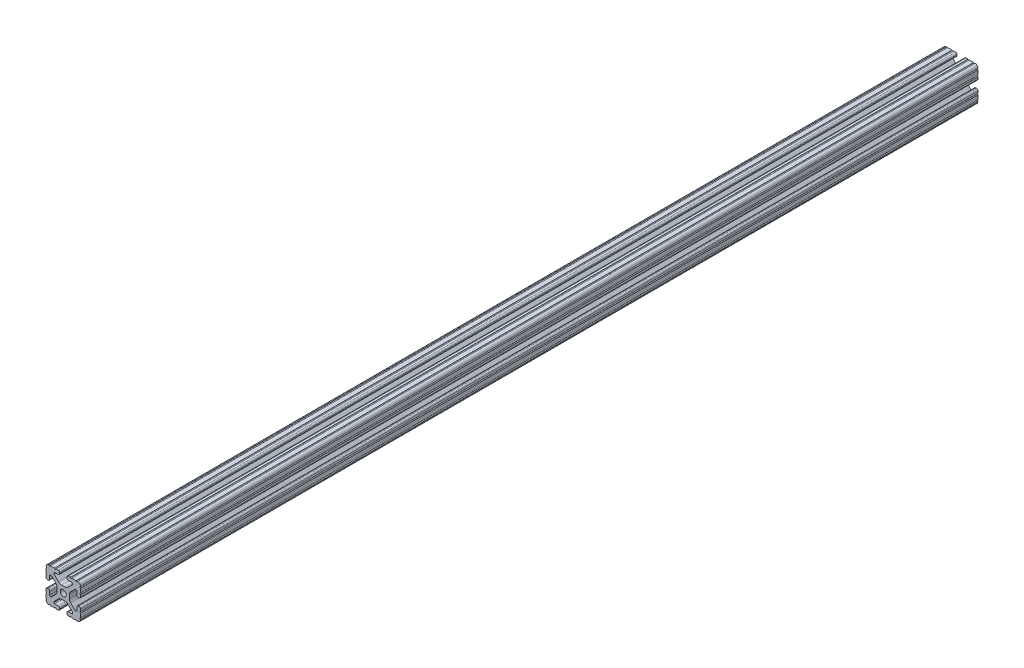
from build123d import *

# Parameters (mm, degrees)
SKETCH1_R      = 3.3274
EXTRUDE1_DEPTH = 990.6


with BuildPart() as part:
    # Sketch1 → Extrude1 (new body)
    with BuildSketch(Plane.XY):
        with BuildLine():
            Line((-10.022898969, 12.91475973), (-5.252158105, 8.144007132))
            ThreePointArc((-5.252158105, 8.144007132), (-3.715177372, 7.117027388), (-1.902183975, 6.7564))
            Line((-1.902183975, 6.7564), (1.902183975, 6.7564))
            ThreePointArc((1.902183975, 6.7564), (3.715177372, 7.117027388), (5.252158105, 8.144007132))
            Line((5.252158105, 8.144007132), (10.022898969, 12.91475973))
            ThreePointArc((10.022898969, 12.91475973), (10.218362387, 13.207291992), (10.287, 13.552357131))
            Line((10.287, 13.552357131), (10.287, 14.0843))
            ThreePointArc((10.287, 14.0843), (10.022898185, 14.721898185), (9.3853, 14.986))
            Line((9.3853, 14.986), (5.617617549, 14.986))
            ThreePointArc((5.617617549, 14.986), (4.519044045, 15.441044045), (4.064, 16.539617549))
            Line((4.064, 16.539617549), (4.064, 17.496382451))
            ThreePointArc((4.064, 17.496382451), (4.519044045, 18.594955955), (5.617617549, 19.05))
            Line((5.617617549, 19.05), (7.974178704, 19.05))
            ThreePointArc((7.974178704, 19.05), (8.736178704, 18.288), (9.498178704, 19.05))
            Line((9.498178704, 19.05), (14.327719207, 19.05))
            ThreePointArc((14.327719207, 19.05), (15.087603123, 18.231251131), (15.847487039, 19.05))
            ThreePointArc((15.847487039, 19.05), (18.120176289, 18.120192083), (19.05, 15.847509295))
            ThreePointArc((19.05, 15.847509295), (18.231250992, 15.08762539), (19.05, 14.327741484))
            Line((19.05, 14.327741484), (19.05, 9.496091471))
            ThreePointArc((19.05, 9.496091471), (18.231250992, 8.736207565), (19.05, 7.97632366))
            Line((19.05, 7.97632366), (19.05, 5.617617549))
            ThreePointArc((19.05, 5.617617549), (18.594955955, 4.519044045), (17.496382451, 4.064))
            Line((17.496382451, 4.064), (16.539617549, 4.064))
            ThreePointArc((16.539617549, 4.064), (15.441044045, 4.519044045), (14.986, 5.617617549))
            Line((14.986, 5.617617549), (14.986, 9.385342516))
            ThreePointArc((14.986, 9.385342516), (14.721898185, 10.022940701), (14.0843, 10.287042516))
            Line((14.0843, 10.287042516), (13.516042086, 10.287042516))
            ThreePointArc((13.516042086, 10.287042516), (13.170975923, 10.218404478), (12.878443117, 10.022939917))
            Line((12.878443117, 10.022939917), (8.14758008, 5.292065243))
            ThreePointArc((8.14758008, 5.292065243), (7.117955879, 3.751120653), (6.7564, 1.933453584))
            Line((6.7564, 1.933453584), (6.7564, -1.933453584))
            ThreePointArc((6.7564, -1.933453584), (7.117955879, -3.751120653), (8.14758008, -5.292065243))
            Line((8.14758008, -5.292065243), (12.878443117, -10.022939917))
            ThreePointArc((12.878443117, -10.022939917), (13.170975923, -10.218404478), (13.516042086, -10.287042516))
            Line((13.516042086, -10.287042516), (14.0843, -10.287042516))
            ThreePointArc((14.0843, -10.287042516), (14.721898185, -10.022940701), (14.986, -9.385342516))
            Line((14.986, -9.385342516), (14.986, -5.617617549))
            ThreePointArc((14.986, -5.617617549), (15.441044045, -4.519044045), (16.539617549, -4.064))
            Line((16.539617549, -4.064), (17.496382451, -4.064))
            ThreePointArc((17.496382451, -4.064), (18.594955955, -4.519044045), (19.05, -5.617617549))
            Line((19.05, -5.617617549), (19.05, -7.976318491))
            ThreePointArc((19.05, -7.976318491), (18.231250992, -8.736202396), (19.05, -9.496086302))
            Line((19.05, -9.496086302), (19.05, -14.32774291))
            ThreePointArc((19.05, -14.32774291), (18.231250992, -15.087626816), (19.05, -15.847510721))
            ThreePointArc((19.05, -15.847510721), (18.120175716, -18.120192644), (15.847486868, -19.05))
            ThreePointArc((15.847486868, -19.05), (15.087602952, -18.231251131), (14.327719036, -19.05))
            Line((14.327719036, -19.05), (9.496062448, -19.05))
            ThreePointArc((9.496062448, -19.05), (8.736178532, -18.231251131), (7.976294616, -19.05))
            Line((7.976294616, -19.05), (5.617617549, -19.05))
            ThreePointArc((5.617617549, -19.05), (4.519044045, -18.594955955), (4.064, -17.496382451))
            Line((4.064, -17.496382451), (4.064, -16.539617549))
            ThreePointArc((4.064, -16.539617549), (4.519044045, -15.441044045), (5.617617549, -14.986))
            Line((5.617617549, -14.986), (9.3853, -14.986))
            ThreePointArc((9.3853, -14.986), (10.022898185, -14.721898185), (10.287, -14.0843))
            Line((10.287, -14.0843), (10.287, -13.552357131))
            ThreePointArc((10.287, -13.552357131), (10.218362387, -13.207291992), (10.022898969, -12.91475973))
            Line((10.022898969, -12.91475973), (5.252158105, -8.144007132))
            ThreePointArc((5.252158105, -8.144007132), (3.715177372, -7.117027388), (1.902183975, -6.7564))
            Line((1.902183975, -6.7564), (-1.902183975, -6.7564))
            ThreePointArc((-1.902183975, -6.7564), (-3.715177372, -7.117027388), (-5.252158105, -8.144007132))
            Line((-5.252158105, -8.144007132), (-10.022898969, -12.91475973))
            ThreePointArc((-10.022898969, -12.91475973), (-10.218362387, -13.207291992), (-10.287, -13.552357131))
            Line((-10.287, -13.552357131), (-10.287, -14.0843))
            ThreePointArc((-10.287, -14.0843), (-10.022898185, -14.721898185), (-9.3853, -14.986))
            Line((-9.3853, -14.986), (-5.617617549, -14.986))
            ThreePointArc((-5.617617549, -14.986), (-4.519044045, -15.441044045), (-4.064, -16.539617549))
            Line((-4.064, -16.539617549), (-4.064, -17.496382451))
            ThreePointArc((-4.064, -17.496382451), (-4.519044045, -18.594955955), (-5.617617549, -19.05))
            Line((-5.617617549, -19.05), (-7.976294616, -19.05))
            ThreePointArc((-7.976294616, -19.05), (-8.736178532, -18.231251131), (-9.496062448, -19.05))
            Line((-9.496062448, -19.05), (-14.327719036, -19.05))
            ThreePointArc((-14.327719036, -19.05), (-15.087602952, -18.231251131), (-15.847486868, -19.05))
            ThreePointArc((-15.847486868, -19.05), (-18.120175716, -18.120192644), (-19.05, -15.847510721))
            ThreePointArc((-19.05, -15.847510721), (-18.231250992, -15.087626816), (-19.05, -14.32774291))
            Line((-19.05, -14.32774291), (-19.05, -9.496086302))
            ThreePointArc((-19.05, -9.496086302), (-18.231250992, -8.736202396), (-19.05, -7.976318491))
            Line((-19.05, -7.976318491), (-19.05, -5.617617549))
            ThreePointArc((-19.05, -5.617617549), (-18.594955955, -4.519044045), (-17.496382451, -4.064))
            Line((-17.496382451, -4.064), (-16.539617549, -4.064))
            ThreePointArc((-16.539617549, -4.064), (-15.441044045, -4.519044045), (-14.986, -5.617617549))
            Line((-14.986, -5.617617549), (-14.986, -9.385342516))
            ThreePointArc((-14.986, -9.385342516), (-14.721898185, -10.022940701), (-14.0843, -10.287042516))
            Line((-14.0843, -10.287042516), (-13.516042086, -10.287042516))
            ThreePointArc((-13.516042086, -10.287042516), (-13.170975923, -10.218404478), (-12.878443117, -10.022939917))
            Line((-12.878443117, -10.022939917), (-8.14758008, -5.292065243))
            ThreePointArc((-8.14758008, -5.292065243), (-7.117955879, -3.751120653), (-6.7564, -1.933453584))
            Line((-6.7564, -1.933453584), (-6.7564, 1.933453584))
            ThreePointArc((-6.7564, 1.933453584), (-7.117955879, 3.751120653), (-8.14758008, 5.292065243))
            Line((-8.14758008, 5.292065243), (-12.878443117, 10.022939917))
            ThreePointArc((-12.878443117, 10.022939917), (-13.170975923, 10.218404478), (-13.516042086, 10.287042516))
            Line((-13.516042086, 10.287042516), (-14.0843, 10.287042516))
            ThreePointArc((-14.0843, 10.287042516), (-14.721898185, 10.022940701), (-14.986, 9.385342516))
            Line((-14.986, 9.385342516), (-14.986, 5.617617549))
            ThreePointArc((-14.986, 5.617617549), (-15.441044045, 4.519044045), (-16.539617549, 4.064))
            Line((-16.539617549, 4.064), (-17.496382451, 4.064))
            ThreePointArc((-17.496382451, 4.064), (-18.594955955, 4.519044045), (-19.05, 5.617617549))
            Line((-19.05, 5.617617549), (-19.05, 7.97632366))
            ThreePointArc((-19.05, 7.97632366), (-18.231250992, 8.736207565), (-19.05, 9.496091471))
            Line((-19.05, 9.496091471), (-19.05, 14.327741484))
            ThreePointArc((-19.05, 14.327741484), (-18.231250992, 15.08762539), (-19.05, 15.847509295))
            ThreePointArc((-19.05, 15.847509295), (-18.120176289, 18.120192083), (-15.847487039, 19.05))
            ThreePointArc((-15.847487039, 19.05), (-15.087603123, 18.231251131), (-14.327719207, 19.05))
            Line((-14.327719207, 19.05), (-9.498178704, 19.05))
            ThreePointArc((-9.498178704, 19.05), (-8.736178704, 18.288), (-7.974178704, 19.05))
            Line((-7.974178704, 19.05), (-5.617617549, 19.05))
            ThreePointArc((-5.617617549, 19.05), (-4.519044045, 18.594955955), (-4.064, 17.496382451))
            Line((-4.064, 17.496382451), (-4.064, 16.539617549))
            ThreePointArc((-4.064, 16.539617549), (-4.519044045, 15.441044045), (-5.617617549, 14.986))
            Line((-5.617617549, 14.986), (-9.3853, 14.986))
            ThreePointArc((-9.3853, 14.986), (-10.022898185, 14.721898185), (-10.287, 14.0843))
            Line((-10.287, 14.0843), (-10.287, 13.552357131))
            ThreePointArc((-10.287, 13.552357131), (-10.218362387, 13.207291992), (-10.022898969, 12.91475973))
        make_face()
        Circle(SKETCH1_R, mode=Mode.SUBTRACT)
    extrude(amount=-EXTRUDE1_DEPTH)


solid = part.part
